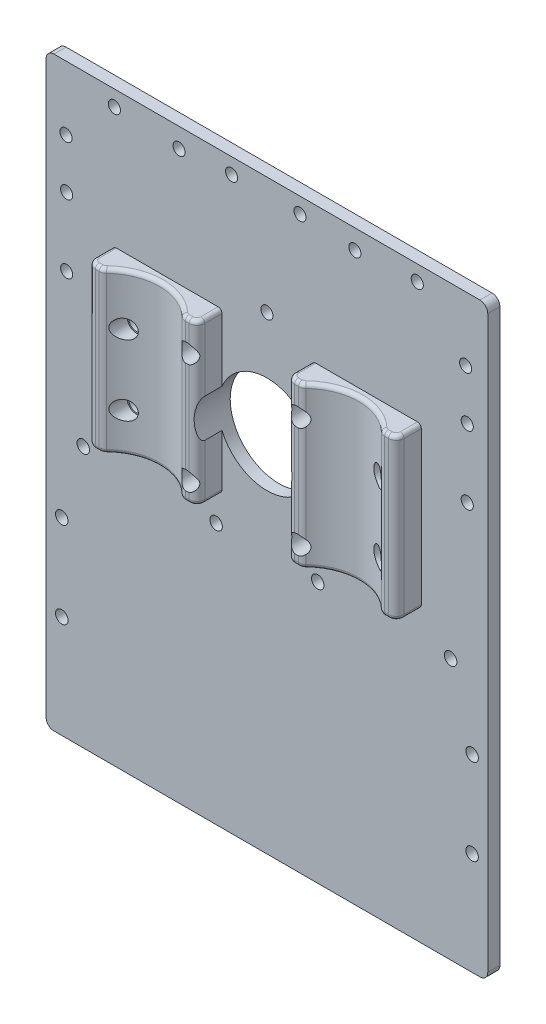
from build123d import *

# Parameters (mm, degrees)
SKETCH1_W                       = 113
SKETCH1_H                       = 150
BOSS_EXTRUDE1_DEPTH             = 3.1
SKETCH3_R                       = 1.6
GEARASSEM_MOUNT_DEPTH           = 94.9513704
SKETCH5_R                       = 1.55
CUT_EXTRUDE3_DEPTH              = 94.9513704
SKETCH6_R                       = 1.55
CUT_EXTRUDE4_DEPTH              = 94.9513704
BOSS_EXTRUDE2_START             = -115
BOSS_EXTRUDE2_DEPTH             = 41
SKETCH10_R                      = 1.55
BASE_PILLAR_MOUNT_PATTERN_DEPTH = 10
FILLET1_R                       = 2
SKETCH11_R                      = 2
COLOUR_SENSOR_DEPTH             = 95.379769075
SKETCH9_R                       = 2
CUT_EXTRUDE8_DEPTH              = 95.379769075
SKETCH12_R                      = 12.5
CUT_EXTRUDE9_DEPTH              = 95.379769085
FILLET2_R                       = 2
FILLET3_R                       = 1
CUT_EXTRUDE10_START             = -4
SKETCH13_R                      = 2.375
SKETCH13_R_2                    = 2
CUT_EXTRUDE10_DEPTH             = 91.379769085


with BuildPart() as part:
    # Sketch1 → Boss-Extrude1 (new body)
    with BuildSketch(Plane.XY):
        Rectangle(SKETCH1_W, SKETCH1_H)
    extrude(amount=BOSS_EXTRUDE1_DEPTH)

    # Sketch3 → GearAssem_Mount (cut, through all)
    with BuildSketch(Plane.XY.offset(3.1)):
        with Locations((-47, -8.2)):
            Circle(SKETCH3_R)
        with Locations((-13, -8.2)):
            Circle(SKETCH3_R)
        with Locations((-52.5, -26.7)):
            Circle(SKETCH3_R)
        with Locations((-52.5, -48.7)):
            Circle(SKETCH3_R)
    gearassem_mount = extrude(amount=-GEARASSEM_MOUNT_DEPTH, mode=Mode.SUBTRACT)

    # Mirror1: GearAssem_Mount across plane
    add(gearassem_mount.mirror(Plane(origin=(0, 0, 0), x_dir=(0, 0, 1), z_dir=(1, 0, 0))), mode=Mode.SUBTRACT)

    # Sketch5 → Cut-Extrude3 (cut, through all)
    with BuildSketch(Plane.XY.offset(3.1)):
        with Locations((-22.5, 70)):
            Circle(SKETCH5_R)
        with Locations((22.5, 70)):
            Circle(SKETCH5_R)
    extrude(amount=-CUT_EXTRUDE3_DEPTH, mode=Mode.SUBTRACT)

    # Sketch6 → Cut-Extrude4 (cut, through all)
    with BuildSketch(Plane.XY.offset(3.1)):
        with Locations((-39.03894948, 71)):
            Circle(SKETCH6_R)
        with Locations((51.25, 28.5)):
            Circle(SKETCH6_R)
        with Locations((8.46105052, 71)):
            Circle(SKETCH6_R)
        with Locations((-9.03894948, 71)):
            Circle(SKETCH6_R)
        with Locations((-51.25, 28.5)):
            Circle(SKETCH6_R)
        with Locations((-51.413318151, 58.625631329)):
            Circle(SKETCH6_R)
        with Locations((-51.25, 46)):
            Circle(SKETCH6_R)
        with Locations((38.46105052, 71)):
            Circle(SKETCH6_R)
        with Locations((51.25, 46)):
            Circle(SKETCH6_R)
        with Locations((50.835419191, 58.625631329)):
            Circle(SKETCH6_R)
    extrude(amount=-CUT_EXTRUDE4_DEPTH, mode=Mode.SUBTRACT)

    # Sketch7 → Boss-Extrude2 (add)
    with BuildSketch(Plane.XZ.offset(75).offset(BOSS_EXTRUDE2_START)):
        with BuildLine():
            Line((-39.5, 9.502147685), (-39.5, 3.1))
            Line((-39.5, 3.1), (-11.5, 3.1))
            Line((-11.5, 3.1), (-11.5, 9.502147685))
            Line((-11.5, 9.502147685), (-15.307785768, 9.502147685))
            ThreePointArc((-15.307785768, 9.502147685), (-25.5, 5.1), (-35.692214232, 9.502147685))
            Line((-35.692214232, 9.502147685), (-39.5, 9.502147685))
        make_face()
    boss_extrude2 = extrude(amount=BOSS_EXTRUDE2_DEPTH)

    # Mirror2: Boss-Extrude2 across plane
    add(boss_extrude2.mirror(Plane(origin=(0, 0, 0), x_dir=(0, 0, 1), z_dir=(1, 0, 0))))

    # Sketch10 → Base_Pillar_Mount_Pattern (cut)
    with BuildSketch(Plane(origin=(0, 0, 0), x_dir=(-1, 0, 0), z_dir=(0, 0, -1))):
        with Locations((0, 45)):
            Circle(SKETCH10_R)
    extrude(amount=-BASE_PILLAR_MOUNT_PATTERN_DEPTH, mode=Mode.SUBTRACT)

    # Fillet1
    fillet1_edges = [part.edges().sort_by_distance(p)[0] for p in [
        (-11.5, 19.5, 9.502147685),
        (-15.307785768, 19.5, 9.502147685),
        (-35.692214232, 19.5, 9.502147685),
        (-39.5, 19.5, 9.502147685),
        (35.692214232, 19.5, 9.502147685),
        (39.5, 19.5, 9.502147685),
        (11.5, 19.5, 9.502147685),
        (15.307785768, 19.5, 9.502147685),
    ]]
    fillet(fillet1_edges, radius=FILLET1_R)

    # Sketch11 → Colour_Sensor (cut, through all)
    with BuildSketch(Plane(origin=(0, 0, 0), x_dir=(-1, 0, 0), z_dir=(0, 0, -1))):
        with Locations((-32.5, 27)):
            Circle(SKETCH11_R)
        with Locations((-32.5, 9)):
            Circle(SKETCH11_R)
        with Locations((32.5, 27)):
            Circle(SKETCH11_R)
        with Locations((32.5, 9)):
            Circle(SKETCH11_R)
    extrude(amount=-COLOUR_SENSOR_DEPTH, mode=Mode.SUBTRACT)

    # Sketch9 → Cut-Extrude8 (cut, through all)
    with BuildSketch(Plane(origin=(0, 0, 0), x_dir=(-1, 0, 0), z_dir=(0, 0, -1))):
        with Locations((14.142135624, 32.142135624)):
            Circle(SKETCH9_R)
        with Locations((14.142135624, 3.857864376)):
            Circle(SKETCH9_R)
        with Locations((-14.142135624, 3.857864376)):
            Circle(SKETCH9_R)
        with Locations((-14.142135624, 32.142135624)):
            Circle(SKETCH9_R)
    extrude(amount=-CUT_EXTRUDE8_DEPTH, mode=Mode.SUBTRACT)

    # Sketch12 → Cut-Extrude9 (cut, through all)
    with BuildSketch(Plane(origin=(0, 0, 0), x_dir=(-1, 0, 0), z_dir=(0, 0, -1))):
        with Locations((0, 18)):
            Circle(SKETCH12_R)
    extrude(amount=-CUT_EXTRUDE9_DEPTH, mode=Mode.SUBTRACT)

    # Fillet2
    fillet2_edges = [part.edges().sort_by_distance(p)[0] for p in [
        (56.5, -75, 1.55),
        (-56.5, -75, 1.55),
        (56.5, 75, 1.55),
        (-56.5, 75, 1.55),
    ]]
    fillet(fillet2_edges, radius=FILLET2_R)

    # Fillet3
    fillet3_edges = [part.edges().sort_by_distance(p)[0] for p in [
        (12.085786438, -1, 8.916361247),
        (25.5, -1, 5.1),
        (35.780441312, -1, 9.359492979),
        (37.011121067, -1, 9.502147685),
        (38.914213562, -1, 8.916361247),
        (38.914213562, 40, 8.916361247),
        (37.011121067, 40, 9.502147685),
        (35.780441312, 40, 9.359492979),
        (25.5, 40, 5.1),
        (15.219558688, 40, 9.359492979),
        (13.988878933, 40, 9.502147685),
        (12.085786438, 40, 8.916361247),
        (-38.914213562, 40, 8.916361247),
        (-37.011121067, 40, 9.502147685),
        (-35.780441312, 40, 9.359492979),
        (-25.5, 40, 5.1),
        (-15.219558688, 40, 9.359492979),
        (-13.988878933, 40, 9.502147685),
        (-12.085786438, 40, 8.916361247),
        (-12.085786438, -1, 8.916361247),
        (-25.5, -1, 5.1),
        (-35.780441312, -1, 9.359492979),
        (-37.011121067, -1, 9.502147685),
        (-38.914213562, -1, 8.916361247),
        (11.5, -1, 5.301073843),
        (39.5, -1, 5.301073843),
        (39.5, 40, 5.301073843),
        (11.5, 40, 5.301073843),
        (-39.5, 40, 5.301073843),
        (-11.5, 40, 5.301073843),
        (-11.5, -1, 5.301073843),
        (-39.5, -1, 5.301073843),
        (13.988878933, -1, 9.502147685),
        (15.219558688, -1, 9.359492979),
        (-13.988878933, -1, 9.502147685),
        (-15.219558688, -1, 9.359492979),
    ]]
    fillet(fillet3_edges, radius=FILLET3_R)

    # Sketch13 → Cut-Extrude10 (cut, through all)
    # profile 1 of 8: a face of its own
    with BuildSketch(Plane(origin=(0, 0, 0), x_dir=(-1, 0, 0), z_dir=(0, 0, -1)).offset(CUT_EXTRUDE10_START)):
        with Locations((-14.142135624, 32.142135624)):
            Circle(SKETCH13_R)
    # profile 2 of 8: a face of its own
    with BuildSketch(Plane(origin=(0, 0, 0), x_dir=(-1, 0, 0), z_dir=(0, 0, -1)).offset(CUT_EXTRUDE10_START)):
        with Locations((14.142135624, 32.142135624)):
            Circle(SKETCH13_R)
    # profile 3 of 8: a face of its own
    with BuildSketch(Plane(origin=(0, 0, 0), x_dir=(-1, 0, 0), z_dir=(0, 0, -1)).offset(CUT_EXTRUDE10_START)):
        with Locations((14.142135624, 3.857864376)):
            Circle(SKETCH13_R)
    # profile 4 of 8: a face of its own
    with BuildSketch(Plane(origin=(0, 0, 0), x_dir=(-1, 0, 0), z_dir=(0, 0, -1)).offset(CUT_EXTRUDE10_START)):
        with Locations((-14.142135624, 3.857864376)):
            Circle(SKETCH13_R)
    # profile 5 of 8: a face of its own
    with BuildSketch(Plane(origin=(0, 0, 0), x_dir=(-1, 0, 0), z_dir=(0, 0, -1)).offset(CUT_EXTRUDE10_START)):
        with Locations((-32.5, 27)):
            Circle(SKETCH13_R)
        with Locations((-32.5, 27)):
            Circle(SKETCH13_R_2, mode=Mode.SUBTRACT)
    # profile 6 of 8: a face of its own
    with BuildSketch(Plane(origin=(0, 0, 0), x_dir=(-1, 0, 0), z_dir=(0, 0, -1)).offset(CUT_EXTRUDE10_START)):
        with Locations((-32.5, 9)):
            Circle(SKETCH13_R)
    # profile 7 of 8: a face of its own
    with BuildSketch(Plane(origin=(0, 0, 0), x_dir=(-1, 0, 0), z_dir=(0, 0, -1)).offset(CUT_EXTRUDE10_START)):
        with Locations((32.5, 9)):
            Circle(SKETCH13_R)
    # profile 8 of 8: a face of its own
    with BuildSketch(Plane(origin=(0, 0, 0), x_dir=(-1, 0, 0), z_dir=(0, 0, -1)).offset(CUT_EXTRUDE10_START)):
        with Locations((32.5, 27)):
            Circle(SKETCH13_R)
        with Locations((32.5, 27)):
            Circle(SKETCH13_R_2, mode=Mode.SUBTRACT)
    extrude(amount=-CUT_EXTRUDE10_DEPTH, mode=Mode.SUBTRACT)


solid = part.part
